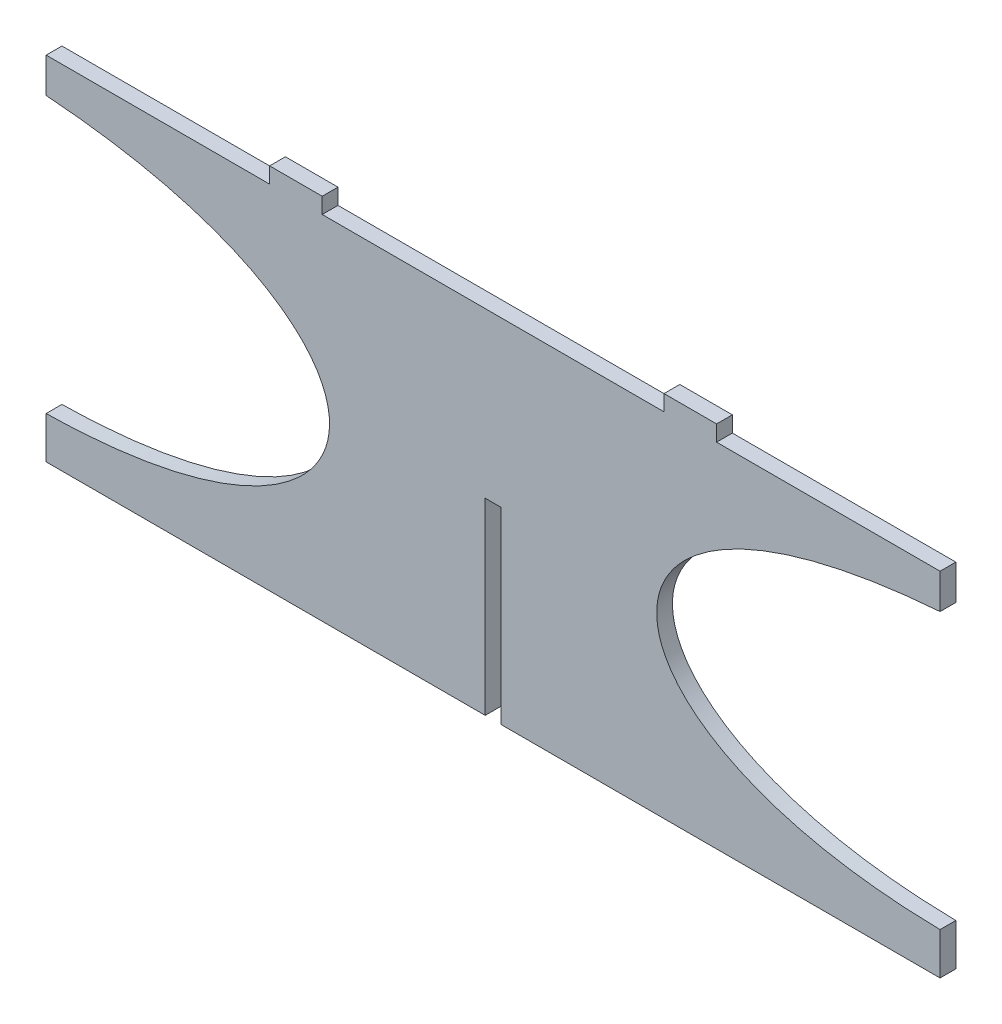
from build123d import *

# Parameters (mm, degrees)
RESSALTO_EXTRUS_O1_DEPTH = 2


with BuildPart() as part:
    # Model → Ressalto-extrusão1 (new body)
    with BuildSketch(Plane.XY):
        with BuildLine():
            Line((-58.8502, -89.6424), (-58.8502, -94.0776))
            add(Edge.make_bspline(
                [(-58.8502, -94.0776), (-9.0376, -97.7844), (-12.8956, -128.2849), (-58.8502, -128.9929)],
                knots=[0.047619048, 0.047619048, 0.047619048, 0.047619048, 0.095238095, 0.095238095, 0.095238095, 0.095238095], degree=3))
            Line((-58.8502, -128.9929), (-58.8502, -134.309))
            Line((-58.8502, -134.309), (-3.1835, -134.309))
            Line((-3.1835, -134.309), (-3.1835, -110.4605))
            Line((-3.1835, -110.4605), (-1.1835, -110.4605))
            Line((-1.1835, -110.4605), (-1.1835, -134.309))
            Line((-1.1835, -134.309), (54.4831, -134.309))
            Line((54.4831, -134.309), (54.4831, -128.9929))
            add(Edge.make_bspline(
                [(54.4831, -128.9929), (8.5266, -128.2849), (4.6696, -97.7845), (54.4831, -94.0776)],
                knots=[0.428571429, 0.428571429, 0.428571429, 0.428571429, 0.476190476, 0.476190476, 0.476190476, 0.476190476], degree=3))
            Line((54.4831, -94.0776), (54.4831, -89.6424))
            Line((54.4831, -89.6424), (26.1498, -89.6424))
            Line((26.1498, -89.6424), (26.1498, -87.6372))
            Line((26.1498, -87.6372), (19.4831, -87.6372))
            Line((19.4831, -87.6372), (19.4831, -89.6424))
            Line((19.4831, -89.6424), (-23.8502, -89.6424))
            Line((-23.8502, -89.6424), (-23.8502, -87.6372))
            Line((-23.8502, -87.6372), (-30.5169, -87.6372))
            Line((-30.5169, -87.6372), (-30.5169, -89.6424))
            Line((-30.5169, -89.6424), (-58.8502, -89.6424))
        make_face()
    extrude(amount=RESSALTO_EXTRUS_O1_DEPTH)


solid = part.part
